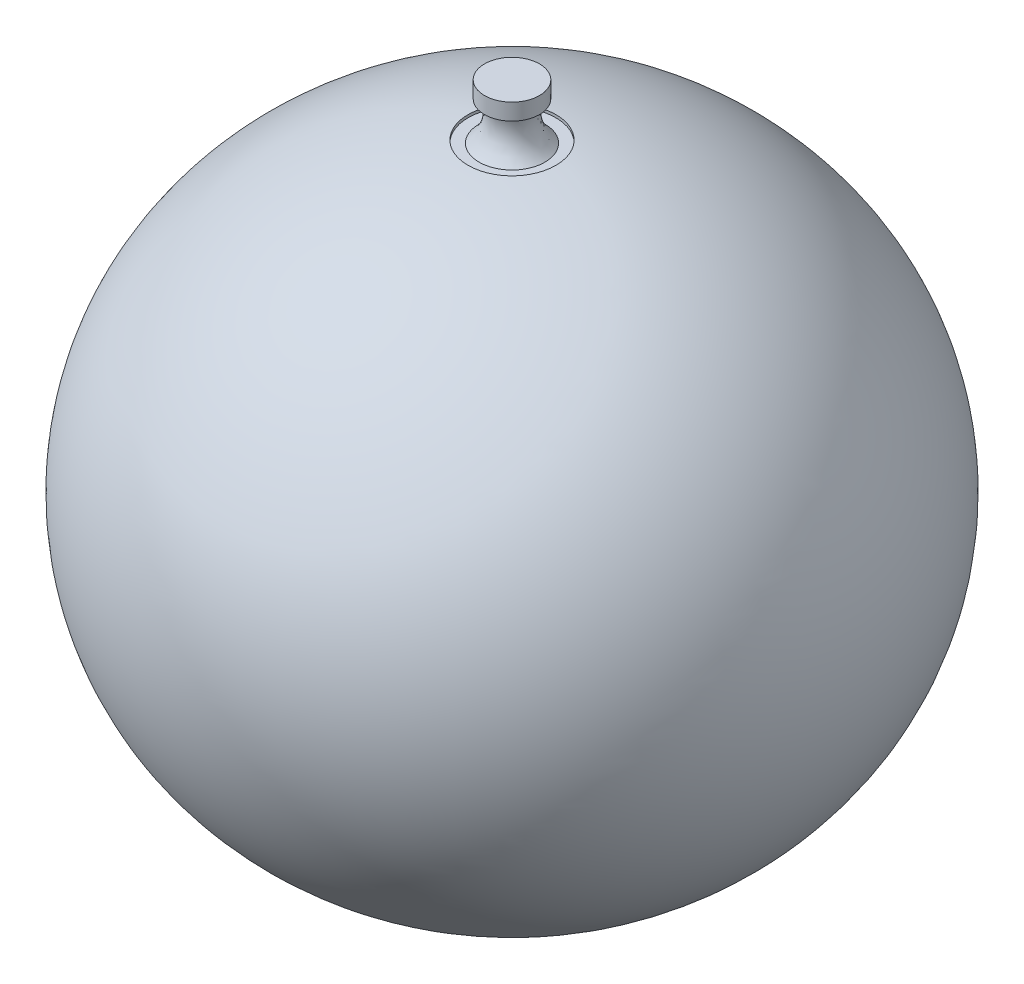
from build123d import *

# Parameters (mm, degrees)
SKETCH_9_R          = 4
CUT_EXTRUDE_3_DEPTH = 0.5


with BuildPart() as part:
    # 草图2 → 旋转1 (revolve)
    with BuildSketch(Plane.XY):
        with BuildLine():
            Line((0, 28), (0, -28))
            add(Edge.make_bspline(
                [(0, -28), (30, -28), (30, 0), (30, 28), (0, 28)],
                knots=[4.71238898, 4.71238898, 4.71238898, 6.283185307, 6.283185307, 7.853981634, 7.853981634, 7.853981634], degree=2, weights=[1, 0.707106781, 1, 0.707106781, 1]))
        make_face()
    revolve(axis=Axis((0, 28, 0), (0, -1, 0)))

    # 草图9 → 切除-拉伸3 (cut)
    with BuildSketch(Plane(origin=(0, 28, 0), x_dir=(1, 0, 0), z_dir=(0, 1, 0))):
        with Locations(Location((0, 0, 0), (0, 0, 270))):
            Circle(SKETCH_9_R)
    extrude(amount=-CUT_EXTRUDE_3_DEPTH, mode=Mode.SUBTRACT)

    # 草图10 → 旋转2 (revolve)
    with BuildSketch(Plane.XY, mode=Mode.PRIVATE) as revolve_2_sk:
        with BuildLine():
            Line((0, 27.5), (3, 27.5))
            add(Edge.make_bspline(
                [(2, 31), (1.428667746, 28.919998941), (3, 27.5)],
                knots=[0, 0, 0, 1, 1, 1], degree=2))
            Line((2, 31), (2.5, 31))
            Line((2.5, 31), (2.5, 32.5))
            Line((2.5, 32.5), (0, 32.5))
            Line((0, 32.5), (0, 27.5))
        make_face()
    revolve(revolve_2_sk.sketch.rotate(Axis((0, 27.5, 0), (0, 1, 0)), 90), axis=Axis((0, 27.5, 0), (0, 1, 0)))

    # 草图11 → 切除-旋转1 (revolve, cut)
    with BuildSketch(Plane.XY):
        with BuildLine():
            Line((0, 20), (0, -20))
            ThreePointArc((0, -20), (20, 0), (0, 20))
        make_face()
    revolve(axis=Axis((0, 20, 0), (0, -1, 0)), mode=Mode.SUBTRACT)


solid = part.part
